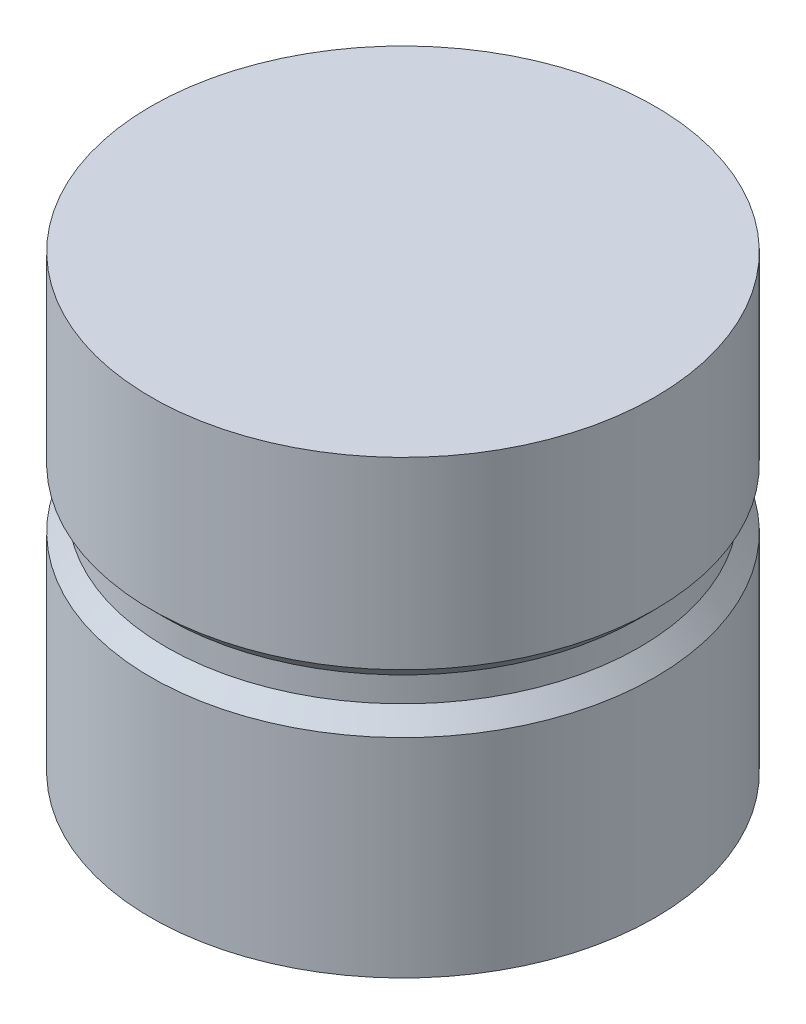
from build123d import *


with BuildPart() as part:
    # Эскиз1 → Повернуть1 (revolve)
    with BuildSketch(Plane.XY):
        Polygon((0, 32.2), (0, 34), (19, 34), (19, 20.13038541), (17.844679199, 18.975064609), (17.844679199, 17.089936456), (19, 15.700016934), (19, 0), (17.2, 0), (17.2, 15.700016934), (16.044679199, 17.089936456), (16.044679199, 18.975064609), (17.2, 20.13038541), (17.2, 32.2), align=None)
    revolve(axis=Axis((0, 32.2, 0), (0, 1, 0)))


solid = part.part
